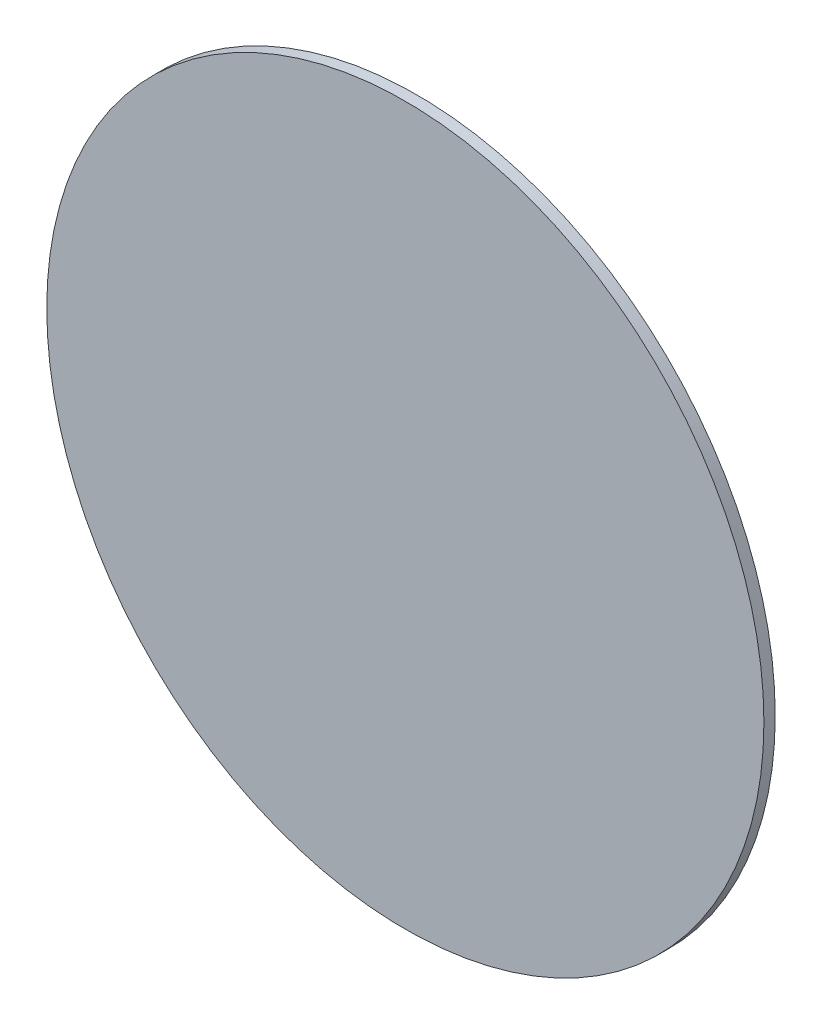
from build123d import *

# Parameters (mm, degrees)
SKETCH1_R           = 95
BOSS_EXTRUDE1_DEPTH = 3


with BuildPart() as part:
    # Sketch1 → Boss-Extrude1 (new body)
    with BuildSketch(Plane.XY):
        Circle(SKETCH1_R)
    extrude(amount=BOSS_EXTRUDE1_DEPTH)


solid = part.part
